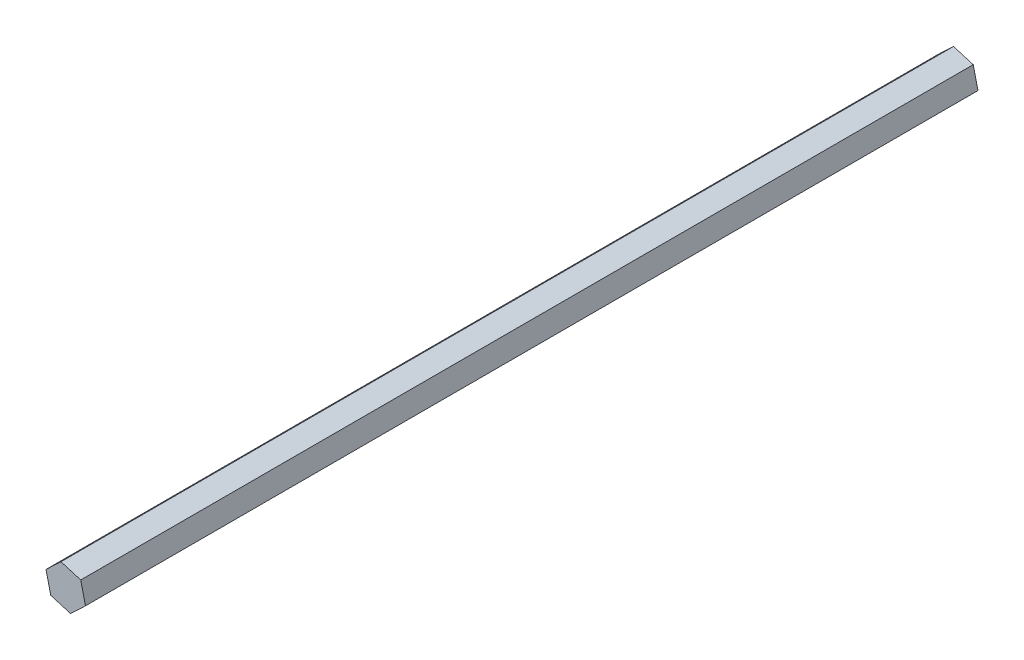
from build123d import *

# Parameters (mm, degrees)
BOSS_EXTRUDE1_DEPTH = 317.5


with BuildPart() as part:
    # Sketch1 → Boss-Extrude1 (new body)
    with BuildSketch(Plane.XY):
        Polygon((5.330713739, 5.034562976), (-1.694702565, 7.133815007), (-7.025416304, 2.099252031), (-5.330713739, -5.034562976), (1.694702565, -7.133815007), (7.025416304, -2.099252031), align=None)
    extrude(amount=BOSS_EXTRUDE1_DEPTH)


solid = part.part
